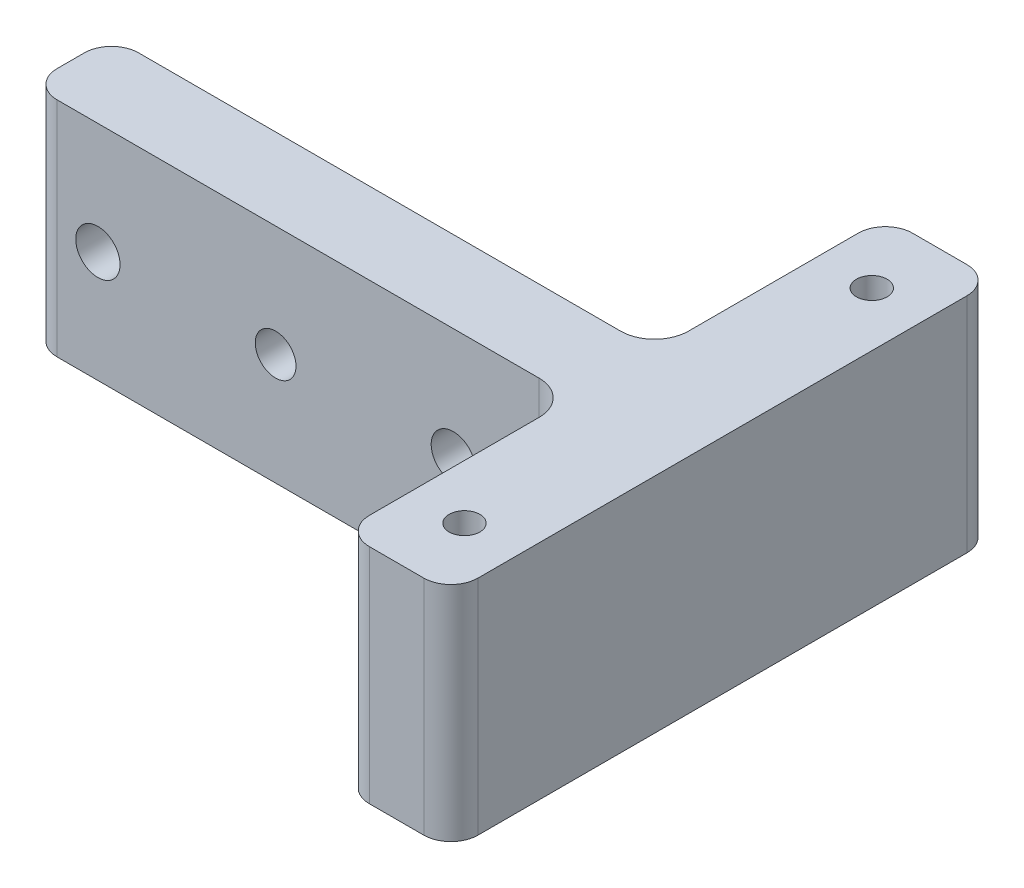
from build123d import *

# Parameters (mm, degrees)
BOSS_EXTRUDE1_DEPTH   = 16.4
F_4_40_TAPPED_HOLE1_D = 2.2606
F_3_0MM_DOWEL_HOLE1_D = 3
F_4_CLEARANCE_HOLE1_D = 3.2639
FILLET1_R             = 2.5
FILLET2_R             = 2


with BuildPart() as part:
    # Sketch1 → Boss-Extrude1 (new body)
    with BuildSketch(Plane(origin=(0, 0, 0), x_dir=(1, 0, 0), z_dir=(0, 1, 0))):
        Polygon((-4, -3), (-4, -20), (4, -20), (4, 20), (-4, 20), (-4, 3), (-44, 3), (-44, -3), align=None)
    extrude(amount=BOSS_EXTRUDE1_DEPTH)

    # #4-40 Tapped Hole1 (through all)
    with Locations(Plane(origin=(0, 16.4, 0), x_dir=(1, 0, 0), z_dir=(0, 1, 0))):
        with Locations((0, 15), (0, -15)):
            Hole(F_4_40_TAPPED_HOLE1_D / 2)

    # Ø3.0mm Dowel Hole1 (through all)
    with Locations(Plane.XY.offset(3)):
        with Locations((-25.91, 8.2)):
            Hole(F_3_0MM_DOWEL_HOLE1_D / 2)

    # #4 Clearance Hole1 (through all)
    with Locations(Plane.XY.offset(3)):
        with Locations((-39, 8.2), (-12.82, 8.2)):
            Hole(F_4_CLEARANCE_HOLE1_D / 2)

    # Fillet1
    fillet1_edges = [part.edges().sort_by_distance(p)[0] for p in [
        (-4, 8.2, 3),
        (-4, 8.2, -3),
    ]]
    fillet(fillet1_edges, radius=FILLET1_R)

    # Fillet2
    fillet2_edges = [part.edges().sort_by_distance(p)[0] for p in [
        (4, 8.2, 20),
        (-4, 8.2, 20),
        (-44, 8.2, 3),
        (-44, 8.2, -3),
        (-4, 8.2, -20),
        (4, 8.2, -20),
    ]]
    fillet(fillet2_edges, radius=FILLET2_R)


solid = part.part
